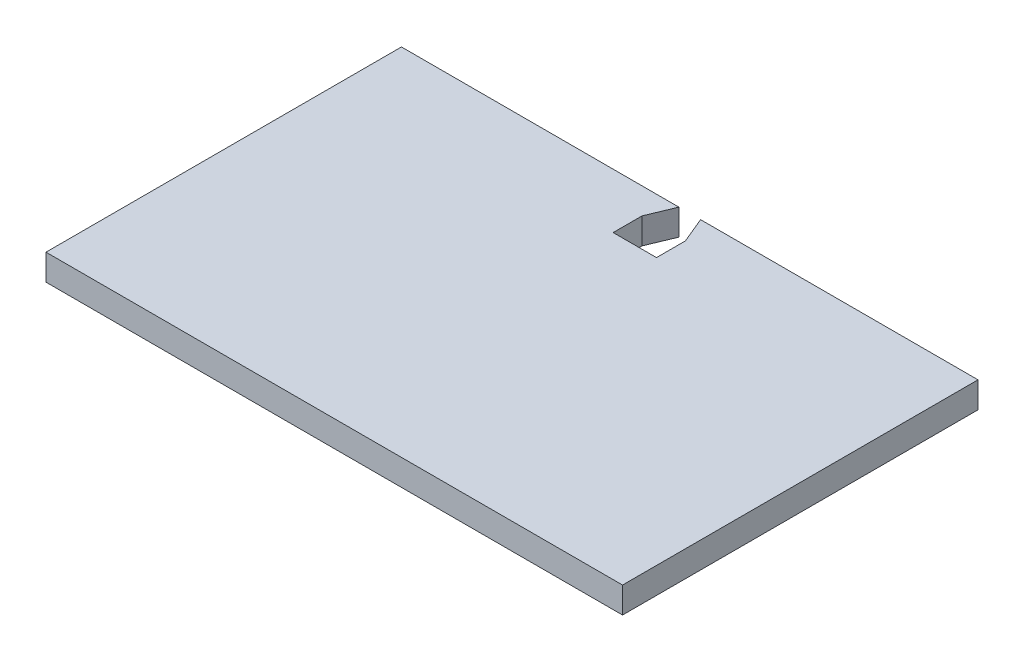
from build123d import *

# Parameters (mm, degrees)
SKETCH1_W           = 399
SKETCH1_H           = 246
BOSS_EXTRUDE1_DEPTH = 18
SKETCH2_W           = 239
SKETCH2_H           = 86
CUT_EXTRUDE1_DEPTH  = 6
CUT_EXTRUDE2_REACH  = 290.215


with BuildPart() as part:
    # Sketch1 → Boss-Extrude1 (new body)
    with BuildSketch(Plane(origin=(0, 0, 0), x_dir=(1, 0, 0), z_dir=(0, 1, 0))):
        with Locations((26.513776337, -54.93719611)):
            Rectangle(SKETCH1_W, SKETCH1_H)
    extrude(amount=BOSS_EXTRUDE1_DEPTH)

    # Sketch2 → Cut-Extrude1 (cut)
    with BuildSketch(Plane.XZ):
        with Locations((26.513776337, 54.93719611)):
            Rectangle(SKETCH2_W, SKETCH2_H)
    extrude(amount=-CUT_EXTRUDE1_DEPTH, mode=Mode.SUBTRACT)

    # Sketch3 → Cut-Extrude2 (cut, up to next)
    with BuildSketch(Plane(origin=(0, 18, 0), x_dir=(1, 0, 0), z_dir=(0, 1, 0)), mode=Mode.PRIVATE) as cut_extrude2_sk1:
        Polygon((34.013776337, 68.06280389), (19.013776337, 68.06280389), (11.513776337, 50.06280389), (11.513776337, 30.06280389), (41.513776337, 30.06280389), (41.513776337, 50.06280389), align=None)
    cut_extrude2_tool1 = extrude(cut_extrude2_sk1.sketch, amount=-CUT_EXTRUDE2_REACH, mode=Mode.PRIVATE) & part.part
    add(cut_extrude2_tool1.solids().sort_by_distance((26.513776, 18, -47.316535))[0], mode=Mode.SUBTRACT)


solid = part.part
